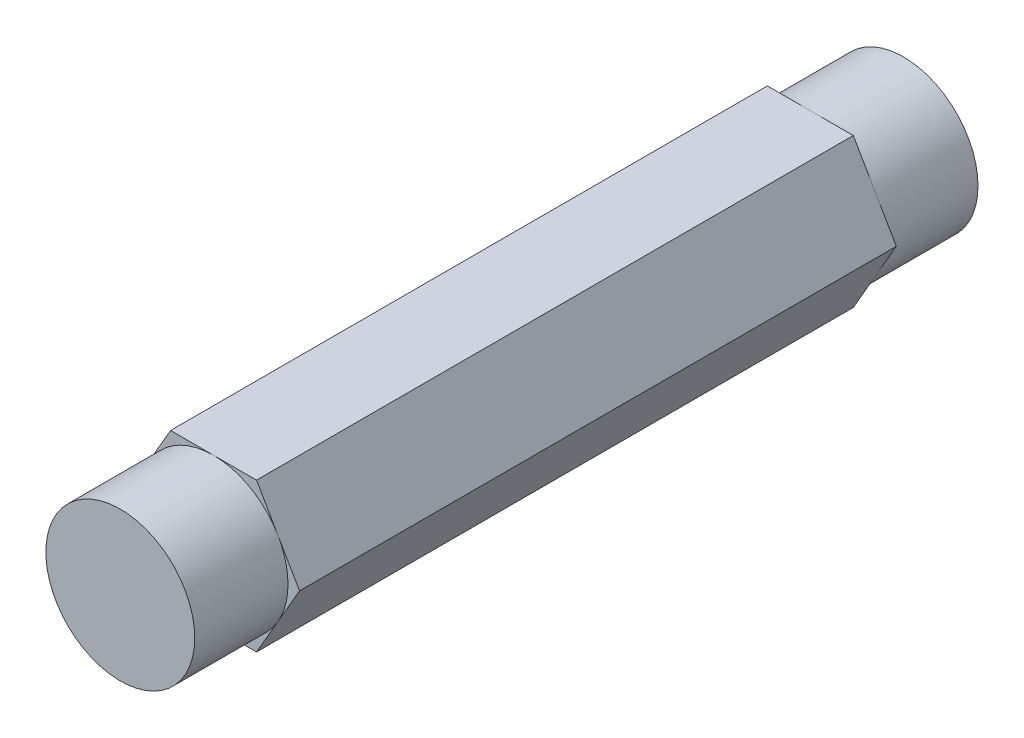
from build123d import *

# Parameters (mm, degrees)
BOSS_EXTRUDE1_DEPTH = 33.401
SKETCH4_OUTSIDE_W   = 30.576
SKETCH4_OUTSIDE_H   = 28.612
SKETCH4_OUTSIDE_R   = 6.35
CUT_EXTRUDE2_DEPTH  = 7.9502


with BuildPart() as part:
    # Sketch1 → Boss-Extrude1 (new, symmetric)
    with BuildSketch(Plane.XY):
        Polygon((7.332348419, 0), (3.666174209, 6.35), (-3.666174209, 6.35), (-7.332348419, 0), (-3.666174209, -6.35), (3.666174209, -6.35), align=None)
    extrude(amount=BOSS_EXTRUDE1_DEPTH, both=True)

    # Sketch4 outside → Cut-Extrude2 (cut)
    with BuildSketch(Plane.XY.offset(33.401)):
        Rectangle(SKETCH4_OUTSIDE_W, SKETCH4_OUTSIDE_H)
        Circle(SKETCH4_OUTSIDE_R, mode=Mode.SUBTRACT)
    cut_extrude2 = extrude(amount=-CUT_EXTRUDE2_DEPTH, mode=Mode.SUBTRACT)

    # Mirror1: Cut-Extrude2 across plane
    add(cut_extrude2.mirror(Plane.XY), mode=Mode.SUBTRACT)


solid = part.part
